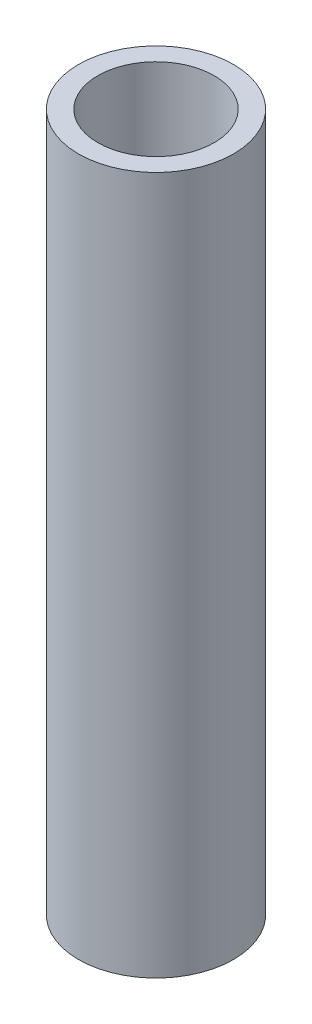
from build123d import *

# Parameters (mm, degrees)
SKETCH1_R           = 12.7
SKETCH1_R_2         = 9.525
BOSS_EXTRUDE2_DEPTH = 114.3


with BuildPart() as part:
    # Sketch1 → Boss-Extrude2 (new body)
    with BuildSketch(Plane(origin=(0, 0, 0), x_dir=(1, 0, 0), z_dir=(0, 1, 0))):
        with Locations(Location((0, 0, 0), (0, 0, 270))):
            Circle(SKETCH1_R)
        with Locations(Location((0, 0, 0), (0, 0, 270))):
            Circle(SKETCH1_R_2, mode=Mode.SUBTRACT)
    extrude(amount=BOSS_EXTRUDE2_DEPTH)


solid = part.part
